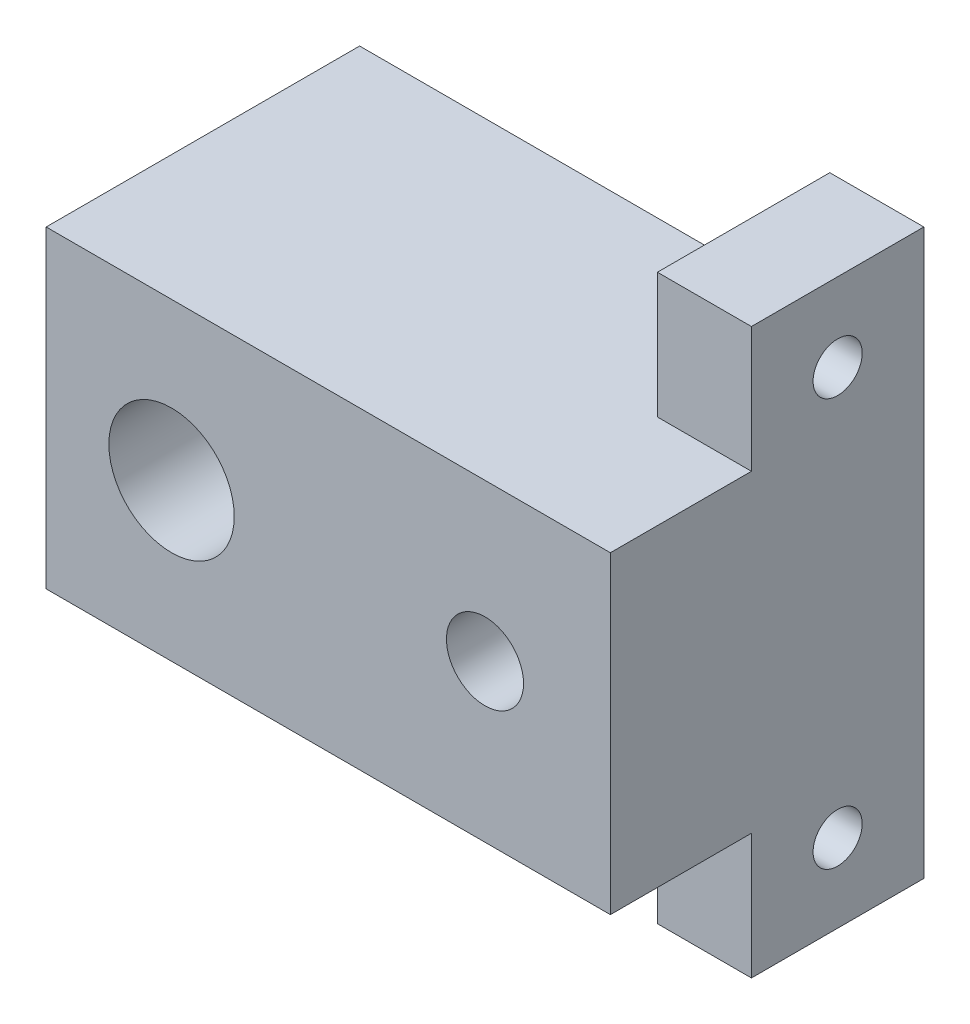
from build123d import *

# Parameters (mm, degrees)
SKETCH1_W                = 18
SKETCH1_H                = 10
BOSS_EXTRUDE1_DEPTH      = 10
SKETCH2_W                = 3
SKETCH2_H                = 5.5
BOSS_EXTRUDE2_DEPTH      = 4
SKETCH3_W                = 3
SKETCH3_H                = 5.5
BOSS_EXTRUDE3_DEPTH      = 4
F_4_0_4_DIAMETER_HOLE1_D = 4


with BuildPart() as part:
    # Sketch1 → Boss-Extrude1 (new body)
    with BuildSketch(Plane.XZ.offset(5)):
        with Locations((-1.5, 5)):
            Rectangle(SKETCH1_W, SKETCH1_H)
    extrude(amount=-BOSS_EXTRUDE1_DEPTH)

    # Sketch2 → Boss-Extrude2 (add)
    with BuildSketch(Plane(origin=(0, 5, 0), x_dir=(-1, 0, 0), z_dir=(0, 1, 0))):
        with Locations((-6, 2.75)):
            Rectangle(SKETCH2_W, SKETCH2_H)
    extrude(amount=BOSS_EXTRUDE2_DEPTH)

    # Sketch3 → Boss-Extrude3 (add)
    with BuildSketch(Plane.XZ.offset(5)):
        with Locations((6, 2.75)):
            Rectangle(SKETCH3_W, SKETCH3_H)
    extrude(amount=BOSS_EXTRUDE3_DEPTH)

    # Sketch4 → Cut-Revolve1 (revolve, cut)
    with BuildSketch(Plane.XY.offset(2.75)):
        Polygon((4.5, 7.2835), (4.5, 6.5), (7.5, 6.5), (7.5, 7.2835), (5.5, 7.2835), align=None)
    revolve(axis=Axis((4.5, 6.5, 2.75), (1, 0, 0)), mode=Mode.SUBTRACT)

    # Sketch5 → Cut-Revolve2 (revolve, cut)
    with BuildSketch(Plane.XY.offset(2.75), mode=Mode.PRIVATE) as cut_revolve2_sk:
        Polygon((4.5, -5.7165), (4.5, -6.5), (7.5, -6.5), (7.5, -5.7165), (5.5, -5.7165), align=None)
    revolve(cut_revolve2_sk.sketch.rotate(Axis((4.5, -6.5, 2.75), (1, 0, 0)), 270), axis=Axis((4.5, -6.5, 2.75), (1, 0, 0)), mode=Mode.SUBTRACT)

    # Sketch6 → Cut-Revolve3 (revolve, cut)
    with BuildSketch(Plane(origin=(0, 0, 0), x_dir=(1, 0, 0), z_dir=(0, 1, 0))):
        Polygon((4.7295, 0), (3.5, 0), (3.5, -10), (4.7295, -10), (4.7295, -8), align=None)
    revolve(axis=Axis((3.5, 0, 0), (0, 0, 1)), mode=Mode.SUBTRACT)

    # Ø4.0 (4) Diameter Hole1 (through all)
    with Locations(Plane(origin=(0, 0, 0), x_dir=(-1, 0, 0), z_dir=(0, 0, -1))):
        with Locations((6.5, 0)):
            Hole(F_4_0_4_DIAMETER_HOLE1_D / 2)


solid = part.part
